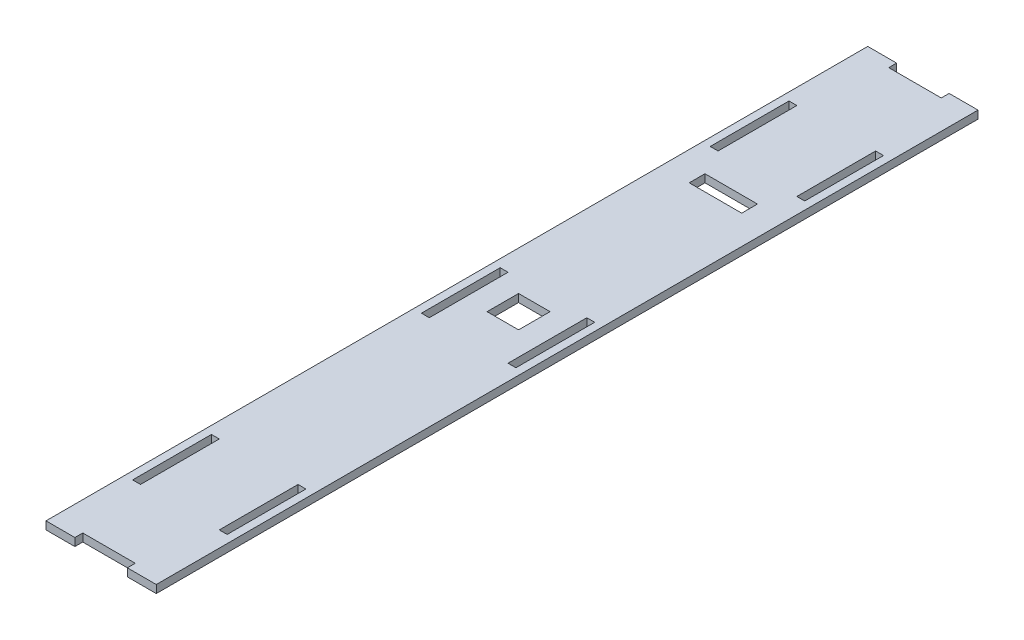
from build123d import *

# Parameters (mm, degrees)
SKETCH1_W           = 3
SKETCH1_H           = 30
SKETCH1_W_2         = 12
SKETCH1_H_2         = 12
SKETCH1_W_3         = 20
SKETCH1_H_3         = 6
BOSS_EXTRUDE1_DEPTH = 3


with BuildPart() as part:
    # Sketch1 → Boss-Extrude1 (new body)
    with BuildSketch(Plane(origin=(0, 0, 0), x_dir=(1, 0, 0), z_dir=(0, 1, 0))):
        Polygon((0, 313), (0, 0), (11, 0), (11, 3), (31, 3), (31, 0), (42, 0), (42, 313), (31, 313), (31, 310), (11, 310), (11, 313), align=None)
        with Locations((4.5, 45)):
            Rectangle(SKETCH1_W, SKETCH1_H, mode=Mode.SUBTRACT)
        with Locations((4.5, 155)):
            Rectangle(SKETCH1_W, SKETCH1_H, mode=Mode.SUBTRACT)
        with Locations((37.5, 45)):
            Rectangle(SKETCH1_W, SKETCH1_H, mode=Mode.SUBTRACT)
        with Locations((37.5, 155)):
            Rectangle(SKETCH1_W, SKETCH1_H, mode=Mode.SUBTRACT)
        with Locations((21, 159)):
            Rectangle(SKETCH1_W_2, SKETCH1_H_2, mode=Mode.SUBTRACT)
        with Locations((4.5, 265)):
            Rectangle(SKETCH1_W, SKETCH1_H, mode=Mode.SUBTRACT)
        with Locations((21, 237)):
            Rectangle(SKETCH1_W_3, SKETCH1_H_3, mode=Mode.SUBTRACT)
        with Locations((37.5, 265)):
            Rectangle(SKETCH1_W, SKETCH1_H, mode=Mode.SUBTRACT)
    extrude(amount=BOSS_EXTRUDE1_DEPTH)


solid = part.part
